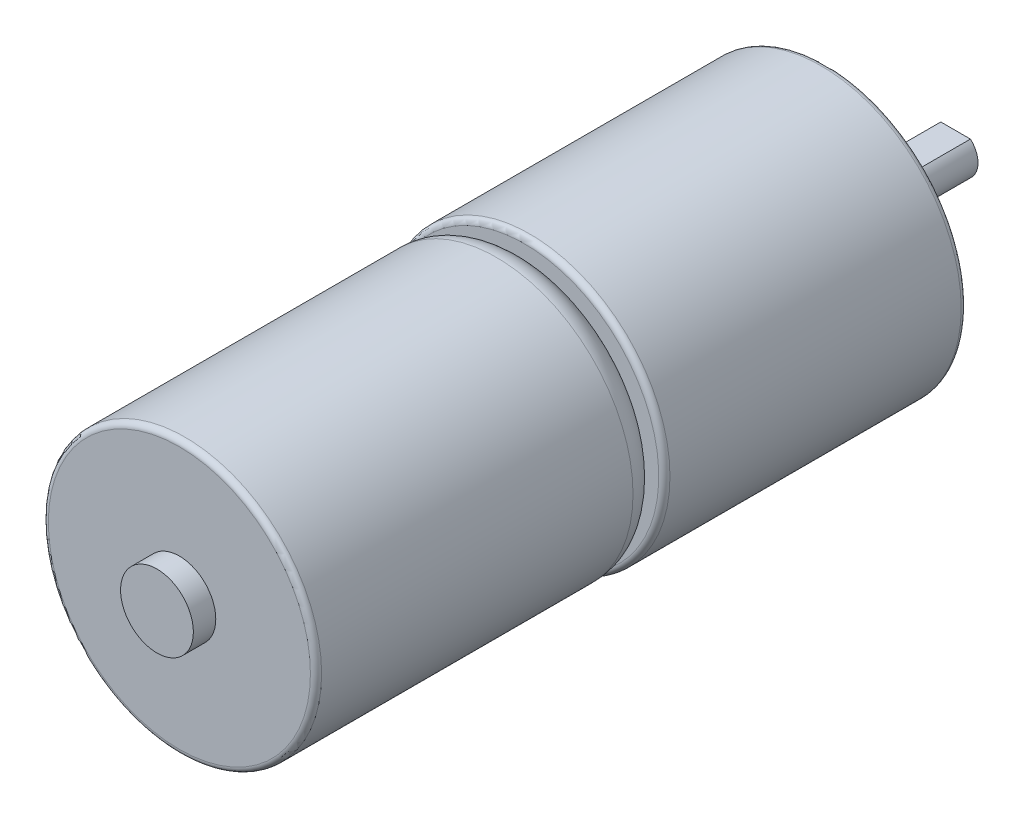
from build123d import *

# Parameters (mm, degrees)
SKETCH_1_R          = 12.2
EXTRUDE_1_DEPTH     = 30.8
SKETCH_2_R          = 3.25
EXTRUDE_2_DEPTH     = 2
FILLET_1_R          = 2.5
SKETCH_3_R          = 12.5
EXTRUDE_3_DEPTH     = 27
SKETCH_4_R          = 3.5
EXTRUDE_4_DEPTH     = 2.5
SKETCH_5_R          = 2
EXTRUDE_5_DEPTH     = 9
CUT_EXTRUDE_START   = -8
CUT_EXTRUDE_1_DEPTH = 8
SKETCH_7_R          = 1.5
CUT_EXTRUDE_2_DEPTH = 18
FILLET_2_R          = 0.5
SKETCH_8_R          = 3.25
CUT_EXTRUDE_3_DEPTH = 5


with BuildPart() as part:
    # ｽｹｯﾁ1 → ﾎﾞｽ - 押し出し1 (new body)
    with BuildSketch(Plane.XY):
        with Locations(Location((0, 0, 0), (0, 0, 180))):
            Circle(SKETCH_1_R)
    extrude(amount=EXTRUDE_1_DEPTH)

    # ｽｹｯﾁ2 → ﾎﾞｽ - 押し出し2 (add)
    with BuildSketch(Plane.XY.offset(30.8)):
        Circle(SKETCH_2_R)
    extrude(amount=EXTRUDE_2_DEPTH)

    # ﾌｨﾚｯﾄ1
    fillet_1_edges = [part.edges().sort_by_distance(p)[0] for p in [
        (12.2, 0, 0),
    ]]
    fillet(fillet_1_edges, radius=FILLET_1_R)

    # ｽｹｯﾁ3 → ﾎﾞｽ - 押し出し3 (add)
    with BuildSketch(Plane(origin=(0, 0, 0), x_dir=(-1, 0, 0), z_dir=(0, 0, -1))):
        Circle(SKETCH_3_R)
    extrude(amount=EXTRUDE_3_DEPTH)

    # ｽｹｯﾁ4 → ﾎﾞｽ - 押し出し4 (add)
    with BuildSketch(Plane(origin=(0, 0, -27), x_dir=(-1, 0, 0), z_dir=(0, 0, -1))):
        Circle(SKETCH_4_R)
    extrude(amount=EXTRUDE_4_DEPTH)

    # ｽｹｯﾁ5 → ﾎﾞｽ - 押し出し5 (add)
    with BuildSketch(Plane(origin=(0, 0, -29.5), x_dir=(-1, 0, 0), z_dir=(0, 0, -1))):
        Circle(SKETCH_5_R)
    extrude(amount=EXTRUDE_5_DEPTH)

    # ｽｹｯﾁ6 → ｶｯﾄ - 押し出し1 (cut)
    with BuildSketch(Plane(origin=(0, 0, -38.5), x_dir=(-1, 0, 0), z_dir=(0, 0, -1)).offset(CUT_EXTRUDE_START)):
        with BuildLine():
            Line((-1.322875656, 1.5), (1.322875656, 1.5))
            ThreePointArc((1.322875656, 1.5), (0, 2), (-1.322875656, 1.5))
        make_face()
    extrude(amount=CUT_EXTRUDE_1_DEPTH, mode=Mode.SUBTRACT)

    # ｽｹｯﾁ7 → ｶｯﾄ - 押し出し2 (cut)
    with BuildSketch(Plane(origin=(0, 0, -27), x_dir=(-1, 0, 0), z_dir=(0, 0, -1))):
        with Locations((0, 8.5)):
            Circle(SKETCH_7_R)
        with Locations((8.5, 0)):
            Circle(SKETCH_7_R)
        with Locations((0, -8.5)):
            Circle(SKETCH_7_R)
        with Locations((-8.5, 0)):
            Circle(SKETCH_7_R)
    extrude(amount=-CUT_EXTRUDE_2_DEPTH, mode=Mode.SUBTRACT)

    # ﾌｨﾚｯﾄ2
    fillet_2_edges = [part.edges().sort_by_distance(p)[0] for p in [
        (12.5, 0, 0),
        (12.5, 0, -27),
        (12.2, 0, 30.8),
    ]]
    fillet(fillet_2_edges, radius=FILLET_2_R)

    # ｽｹｯﾁ8 → ｶｯﾄ - 押し出し3 (cut)
    with BuildSketch(Plane(origin=(0, 0, -27), x_dir=(-1, 0, 0), z_dir=(0, 0, -1))):
        with Locations((0, 8.5)):
            Circle(SKETCH_8_R)
        with Locations((0, -8.5)):
            Circle(SKETCH_8_R)
    extrude(amount=-CUT_EXTRUDE_3_DEPTH, mode=Mode.SUBTRACT)


solid = part.part
